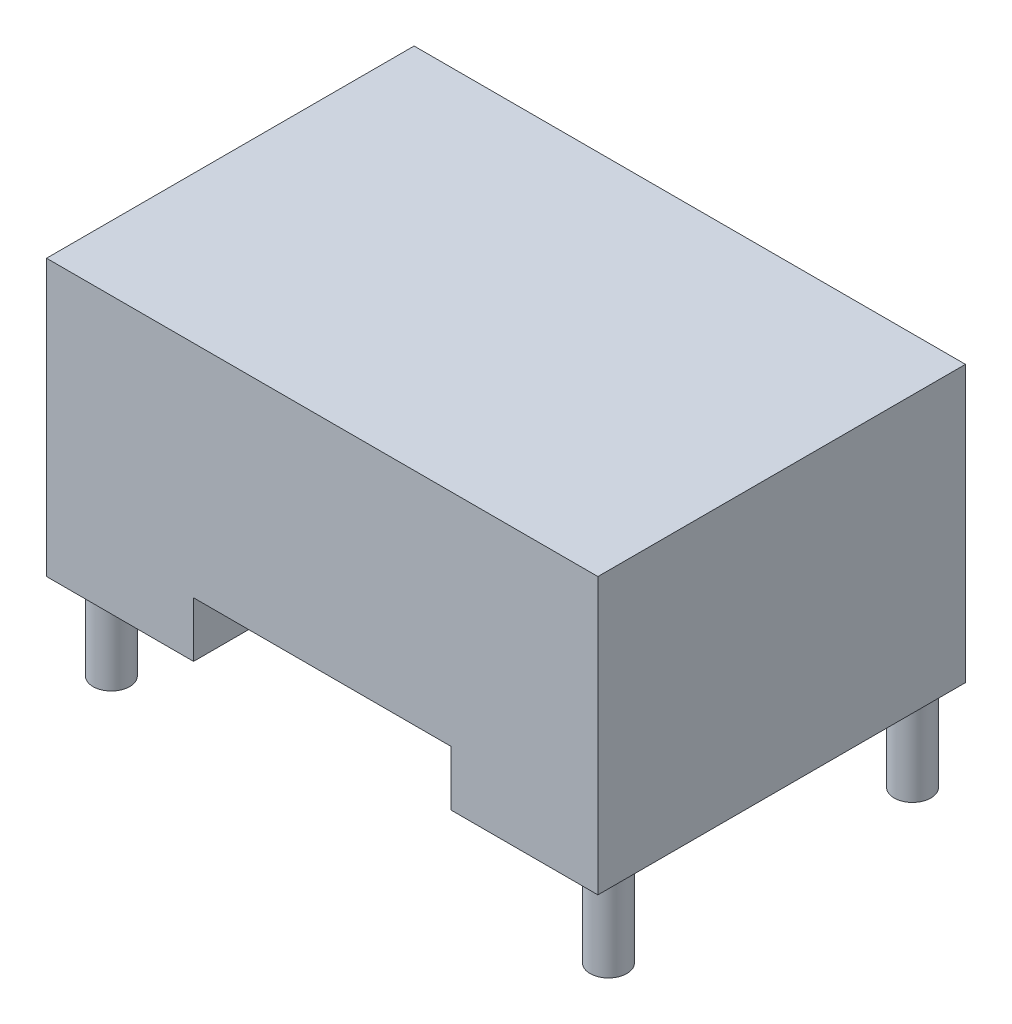
from build123d import *

# Parameters (mm, degrees)
SKETCH1_W           = 3000
SKETCH1_H           = 2000
BOSS_EXTRUDE1_DEPTH = 1500
SKETCH2_W           = 1400
SKETCH2_H           = 2400
CUT_EXTRUDE2_DEPTH  = 300
SKETCH3_R           = 100
BOSS_EXTRUDE2_DEPTH = 500


with BuildPart() as part:
    # Sketch1 → Boss-Extrude1 (new body)
    with BuildSketch(Plane(origin=(0, 0, 0), x_dir=(1, 0, 0), z_dir=(0, 1, 0))):
        Rectangle(SKETCH1_W, SKETCH1_H)
    extrude(amount=BOSS_EXTRUDE1_DEPTH)

    # Sketch2 → Cut-Extrude2 (cut)
    with BuildSketch(Plane(origin=(0, 0, 0), x_dir=(1, 0, 0), z_dir=(0, 1, 0))):
        Rectangle(SKETCH2_W, SKETCH2_H)
    extrude(amount=CUT_EXTRUDE2_DEPTH, mode=Mode.SUBTRACT)

    # Sketch3 → Boss-Extrude2 (add)
    with BuildSketch(Plane(origin=(0, 0, 0), x_dir=(1, 0, 0), z_dir=(0, 1, 0))):
        with Locations(Location((-1354.760271255, 862.120172617, 0), (0, 0, 270))):
            Circle(SKETCH3_R)
        with Locations(Location((1349.833870269, 862.120172617, 0), (0, 0, 270))):
            Circle(SKETCH3_R)
        with Locations(Location((1349.833870269, -792.363091909, 0), (0, 0, 270))):
            Circle(SKETCH3_R)
        with Locations(Location((-1354.760271255, -792.363091909, 0), (0, 0, 270))):
            Circle(SKETCH3_R)
    extrude(amount=-BOSS_EXTRUDE2_DEPTH)


solid = part.part
